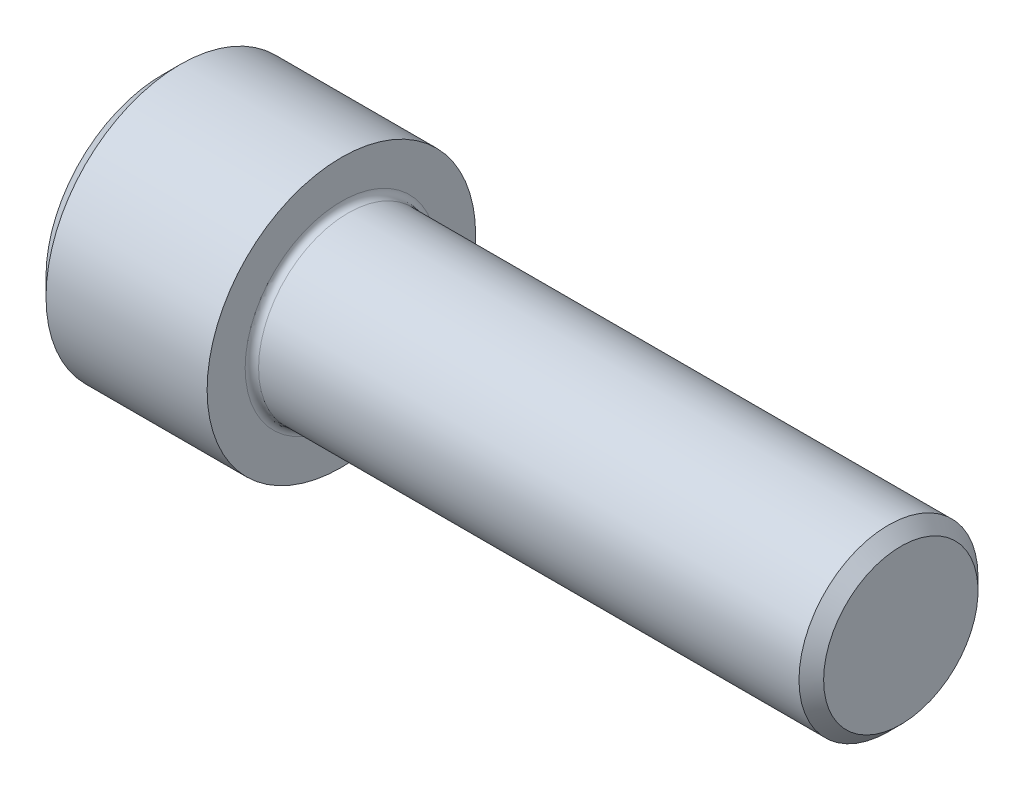
from build123d import *

# Parameters (mm, degrees)
FILLET1_R   = 0.6
HEX_2_DEPTH = 8


with BuildPart() as part:
    # BodySke → Base-Revolve (revolve)
    with BuildSketch(Plane.XY, mode=Mode.PRIVATE) as base_revolve_sk:
        Polygon((0, 0), (0, 10.4), (1.6, 12), (16, 12), (16, 8), (64.8985, 8), (66, 6.8985), (66, 0), align=None)
    revolve(base_revolve_sk.sketch.rotate(Axis((-31.75, 0, 0), (1, 0, 0)), 90), axis=Axis((-31.75, 0, 0), (1, 0, 0)))

    # Fillet1
    fillet1_edges = [part.edges().sort_by_distance(p)[0] for p in [
        (16, 0, -8),
    ]]
    fillet(fillet1_edges, radius=FILLET1_R)

    # Sketch2 → Hex-PreBroach (revolve, cut)
    with BuildSketch(Plane.XY, mode=Mode.PRIVATE) as hex_prebroach_sk:
        Polygon((0, 7.071), (8, 7.071), (12.082443753, 0), (0, 0), align=None)
    revolve(hex_prebroach_sk.sketch.rotate(Axis((0, 0, 0), (1, 0, 0)), 90), axis=Axis((0, 0, 0), (1, 0, 0)), mode=Mode.SUBTRACT)

    # Sketch3 → Hex 2 (cut)
    with BuildSketch(Plane(origin=(0, 0, 0), x_dir=(0, 0.500000000000001, 0.866025403784438), z_dir=(-1, 0, 0))):
        Polygon((4.082443753, 7.071), (-4.082443753, 7.071), (-8.164887507, 0), (-4.082443753, -7.071), (4.082443753, -7.071), (8.164887507, 0), align=None)
    extrude(amount=-HEX_2_DEPTH, mode=Mode.SUBTRACT)


solid = part.part
